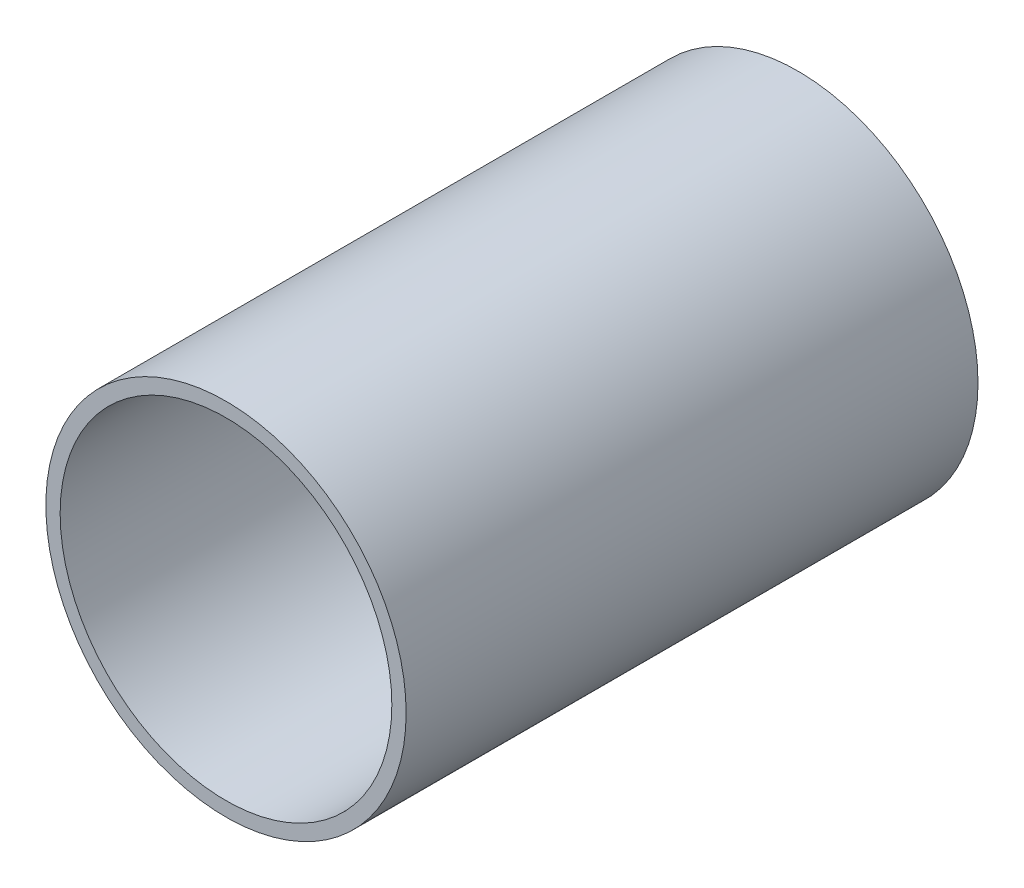
from build123d import *

# Parameters (mm, degrees)
ESQUISSE1_R        = 31.5
ESQUISSE1_R_2      = 29
BOSS_EXTRU_1_DEPTH = 100


with BuildPart() as part:
    # Esquisse1 → Boss.-Extru.1 (new body)
    with BuildSketch(Plane.XY):
        Circle(ESQUISSE1_R)
        Circle(ESQUISSE1_R_2, mode=Mode.SUBTRACT)
    extrude(amount=BOSS_EXTRU_1_DEPTH)


solid = part.part
